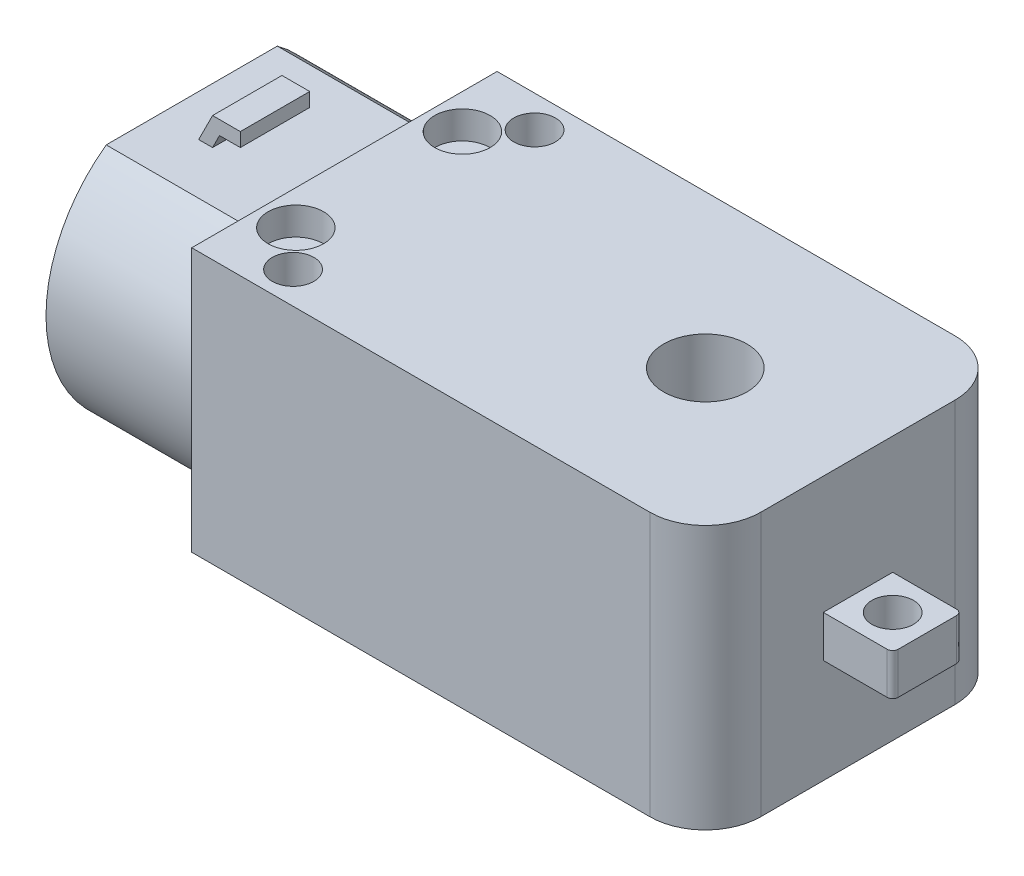
from build123d import *

# Parameters (mm, degrees)
SKETCH1_W           = 37
SKETCH1_H           = 22
BOSS_EXTRUDE1_DEPTH = 10
SKETCH3_W           = 37
SKETCH3_H           = 22
BOSS_EXTRUDE2_DEPTH = 9
SKETCH5_W           = 5
SKETCH5_H           = 3
BOSS_EXTRUDE3_DEPTH = 5
SKETCH6_R           = 1.5
CUT_EXTRUDE1_DEPTH  = 5
FILLET1_R           = 0.4
FILLET2_R           = 4
SKETCH7_R           = 3
CUT_EXTRUDE2_DEPTH  = 44.023249529
SKETCH8_R           = 1.5
CUT_EXTRUDE4_DEPTH  = 44.023249529
SKETCH10_R          = 2
CUT_EXTRUDE5_DEPTH  = 2
BOSS_EXTRUDE4_DEPTH = 11
CUT_EXTRUDE6_DEPTH  = 11
SKETCH13_W          = 3
SKETCH13_H          = 5
BOSS_EXTRUDE5_DEPTH = 2
CUT_EXTRUDE7_DEPTH  = 51.955863254


with BuildPart() as part:
    # Sketch1 → Boss-Extrude1 (new body)
    with BuildSketch(Plane(origin=(0, 0, 0), x_dir=(1, 0, 0), z_dir=(0, 1, 0))):
        with Locations((-18.5, 0)):
            Rectangle(SKETCH1_W, SKETCH1_H)
    extrude(amount=BOSS_EXTRUDE1_DEPTH)

    # Sketch3 → Boss-Extrude2 (add)
    with BuildSketch(Plane.XZ):
        with Locations((-18.5, 0)):
            Rectangle(SKETCH3_W, SKETCH3_H)
    extrude(amount=BOSS_EXTRUDE2_DEPTH)

    # Sketch5 → Boss-Extrude3 (add)
    with BuildSketch(Plane(origin=(0, 0, 0), x_dir=(0, 0, -1), z_dir=(1, 0, 0))):
        Rectangle(SKETCH5_W, SKETCH5_H)
    extrude(amount=BOSS_EXTRUDE3_DEPTH)

    # Sketch6 → Cut-Extrude1 (cut)
    with BuildSketch(Plane(origin=(0, 1.5, 0), x_dir=(1, 0, 0), z_dir=(0, 1, 0))):
        with Locations(Location((2.5, 0, 0), (0, 0, 270))):
            Circle(SKETCH6_R)
    extrude(amount=-CUT_EXTRUDE1_DEPTH, mode=Mode.SUBTRACT)

    # Fillet1
    fillet1_edges = [part.edges().sort_by_distance(p)[0] for p in [
        (5, 0, -2.5),
        (5, 0, 2.5),
    ]]
    fillet(fillet1_edges, radius=FILLET1_R)

    # Fillet2
    fillet2_edges = [part.edges().sort_by_distance(p)[0] for p in [
        (0, 0.5, 11),
        (0, 0.5, -11),
    ]]
    fillet(fillet2_edges, radius=FILLET2_R)

    # Sketch7 → Cut-Extrude2 (cut, through all)
    with BuildSketch(Plane(origin=(0, 10, 0), x_dir=(1, 0, 0), z_dir=(0, 1, 0))):
        with Locations(Location((-11, 0, 0), (0, 0, 270))):
            Circle(SKETCH7_R)
    extrude(amount=-CUT_EXTRUDE2_DEPTH, mode=Mode.SUBTRACT)

    # Sketch8 → Cut-Extrude4 (cut, through all)
    with BuildSketch(Plane(origin=(0, 10, 0), x_dir=(1, 0, 0), z_dir=(0, 1, 0))):
        with Locations(Location((-32, 8.7, 0), (0, 0, 270))):
            Circle(SKETCH8_R)
        with Locations(Location((-32, -8.7, 0), (0, 0, 270))):
            Circle(SKETCH8_R)
    extrude(amount=-CUT_EXTRUDE4_DEPTH, mode=Mode.SUBTRACT)

    # Sketch10 → Cut-Extrude5 (cut)
    with BuildSketch(Plane(origin=(0, 10, 0), x_dir=(1, 0, 0), z_dir=(0, 1, 0))):
        with Locations(Location((-34.5, 6, 0), (0, 0, 270))):
            Circle(SKETCH10_R)
        with Locations(Location((-34.5, -6, 0), (0, 0, 270))):
            Circle(SKETCH10_R)
    extrude(amount=-CUT_EXTRUDE5_DEPTH, mode=Mode.SUBTRACT)

    # Sketch11 → Boss-Extrude4 (add)
    with BuildSketch(Plane.ZY.offset(37)):
        with BuildLine():
            Line((-6.164414003, 8.5), (6.164414003, 8.5))
            ThreePointArc((6.164414003, 8.5), (10.5, 0), (6.164414003, -8.5))
            Line((6.164414003, -8.5), (-6.164414003, -8.5))
            ThreePointArc((-6.164414003, -8.5), (-10.5, 0), (-6.164414003, 8.5))
        make_face()
    extrude(amount=BOSS_EXTRUDE4_DEPTH)

    # Sketch12 → Cut-Extrude6 (cut)
    with BuildSketch(Plane.ZY.offset(48)):
        with BuildLine():
            Line((-5.830951895, -7.5), (5.830951895, -7.5))
            ThreePointArc((5.830951895, -7.5), (9.5, 0), (5.830951895, 7.5))
            Line((5.830951895, 7.5), (-5.830951895, 7.5))
            ThreePointArc((-5.830951895, 7.5), (-9.5, 0), (-5.830951895, -7.5))
        make_face()
    extrude(amount=-CUT_EXTRUDE6_DEPTH, mode=Mode.SUBTRACT)

    # Sketch13 → Boss-Extrude5 (add)
    with BuildSketch(Plane(origin=(0, 8.5, 0), x_dir=(1, 0, 0), z_dir=(0, 1, 0))):
        with Locations((-43.5, 0)):
            Rectangle(SKETCH13_W, SKETCH13_H)
    boss_extrude5 = extrude(amount=BOSS_EXTRUDE5_DEPTH)

    # Sketch14 → Cut-Extrude7 (cut, through all)
    with BuildSketch(Plane.XY.offset(2.5)):
        Polygon((-44.5, 9.5), (-44, 10.5), (-45, 10.5), (-45, 9.5), align=None)
        Polygon((-45, 8.5), (-44.5, 9.5), (-45, 9.5), align=None)
        Polygon((-42, 9.5), (-43.5, 9.5), (-44, 8.5), (-42, 8.5), align=None)
    cut_extrude7 = extrude(amount=-CUT_EXTRUDE7_DEPTH, mode=Mode.SUBTRACT)

    # Mirror2: Boss-Extrude5 across plane
    add(boss_extrude5.mirror(Plane.ZX))

    # Mirror3: Cut-Extrude7 across plane
    add(cut_extrude7.mirror(Plane.ZX), mode=Mode.SUBTRACT)


solid = part.part
